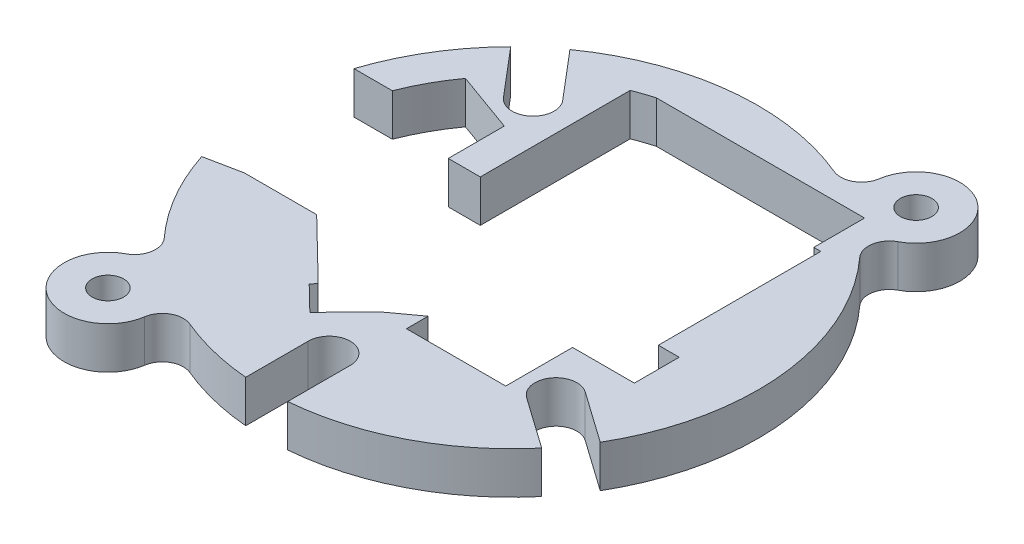
from build123d import *

# Parameters (mm, degrees)
SKETCH1_R             = 1.143
BOSS_EXTRUDE1_DEPTH   = 1.524
BOSS_EXTRUDE1_2_DEPTH = 1.524
SKETCH2_R             = 1.143
CUT_EXTRUDE2_DEPTH    = 26.441049651
SKETCH3_R             = 1.143
BOSS_EXTRUDE2_DEPTH   = 3.048


with BuildPart() as part:
    # Sketch1 → Boss-Extrude1 (new, symmetric)
    with BuildSketch(Plane(origin=(0, 0, 0), x_dir=(1, 0, 0), z_dir=(0, 1, 0))):
        with BuildLine():
            Line((-14.395123673, -5.0038), (-16.984058744, -5.5245))
            ThreePointArc((-16.984058744, -5.5245), (10.284594762, -14.601556843), (10.922, 14.131109924))
            Line((10.922, 14.131109924), (10.922, 10.9728))
            Line((10.922, 10.9728), (11.43, 10.9728))
            Line((11.43, 10.9728), (11.43, -0.8128))
            Line((11.43, -0.8128), (12.9413, -0.8128))
            Line((12.9413, -0.8128), (12.9413, -4.064))
            Line((12.9413, -4.064), (8.4582, -4.064))
            Line((8.4582, -4.064), (8.4582, -8.9154))
            Line((8.4582, -8.9154), (1.2573, -8.9154))
            Line((1.2573, -8.9154), (1.2573, -7.3406))
            Line((1.2573, -7.3406), (-0.7747, -8.8265))
            Line((-0.7747, -8.8265), (-3.273729572, -11.3919))
            Line((-3.273729572, -11.3919), (-5.093162196, -9.619538602))
            Line((-5.093162196, -9.619538602), (-4.769706241, -9.287492148))
            Line((-4.769706241, -9.287492148), (-9.167166743, -5.0038))
            Line((-9.167166743, -5.0038), (-14.395123673, -5.0038))
        make_face()
        with Locations(Location((0, -13.2588, 0), (0, 0, 90))):
            Circle(SKETCH1_R, mode=Mode.SUBTRACT)
        with Locations(Location((10.832526773, -7.6454, 0), (0, 0, 90))):
            Circle(SKETCH1_R, mode=Mode.SUBTRACT)
    extrude(amount=BOSS_EXTRUDE1_DEPTH, both=True)


with BuildPart() as body_2:
    # Sketch1 → Boss-Extrude1 2 (new, symmetric)
    with BuildSketch(Plane(origin=(0, 0, 0), x_dir=(1, 0, 0), z_dir=(0, 1, 0))):
        with BuildLine():
            Line((-4.179129857, 14.6558), (10.207148379, 14.6558))
            ThreePointArc((10.207148379, 14.6558), (-5.685665172, 16.930787437), (-16.984058744, 5.5245))
            Line((-16.984058744, 5.5245), (-14.203432675, 5.5245))
            ThreePointArc((-14.203432675, 5.5245), (-13.378320264, 7.299188099), (-12.332576282, 8.9535))
            Line((-12.332576282, 8.9535), (-7.9248, 7.366))
            Line((-7.9248, 7.366), (-7.9248, 3.302))
            Line((-7.9248, 3.302), (-5.6007, 3.302))
            Line((-5.6007, 3.302), (-5.6007, 14.173558463))
            ThreePointArc((-5.6007, 14.173558463), (-4.895856129, 14.43219293), (-4.179129857, 14.6558))
        make_face()
        with Locations(Location((-8.579035657, 10.1092, 0), (0, 0, 90))):
            Circle(SKETCH1_R, mode=Mode.SUBTRACT)
    extrude(amount=BOSS_EXTRUDE1_2_DEPTH, both=True)


with BuildPart() as cut_extrude2_tool:
    # Sketch2 → Cut-Extrude2 (new, through all)
    # profile 1 of 3: a face of its own
    with BuildSketch(Plane(origin=(0, 1.524, 0), x_dir=(1, 0, 0), z_dir=(0, 1, 0))):
        with BuildLine():
            Line((-12.676023011, 12.581605315), (-9.741012668, 9.123103947))
            ThreePointArc((-9.741012668, 9.123103947), (-7.592939604, 8.947222989), (-7.417058645, 11.095296053))
            Line((-7.417058645, 11.095296053), (-10.352068988, 14.55379742))
            ThreePointArc((-10.352068988, 14.55379742), (-11.556194906, 13.61736799), (-12.676023011, 12.581605315))
        make_face()
        with Locations((-8.579035657, 10.1092)):
            Circle(SKETCH2_R, mode=Mode.SUBTRACT)
    # profile 2 of 3: a face of its own
    with BuildSketch(Plane(origin=(0, 1.524, 0), x_dir=(1, 0, 0), z_dir=(0, 1, 0))):
        with BuildLine():
            Line((1.524, -17.794824407), (1.524, -13.2588))
            ThreePointArc((1.524, -13.2588), (0, -11.7348), (-1.524, -13.2588))
            Line((-1.524, -13.2588), (-1.524, -17.794824407))
            ThreePointArc((-1.524, -17.794824407), (0, -17.859965052), (1.524, -17.794824407))
        make_face()
        with Locations((0, -13.2588)):
            Circle(SKETCH2_R, mode=Mode.SUBTRACT)
    # profile 3 of 3: a face of its own
    with BuildSketch(Plane(origin=(0, 1.524, 0), x_dir=(1, 0, 0), z_dir=(0, 1, 0))):
        with BuildLine():
            Line((9.953745163, -8.89051802), (13.659706927, -11.506118301))
            ThreePointArc((13.659706927, -11.506118301), (14.591708872, -10.298562224), (15.417270145, -9.015882261))
            Line((15.417270145, -9.015882261), (11.711308382, -6.40028198))
            ThreePointArc((11.711308382, -6.40028198), (9.587408753, -6.766618391), (9.953745163, -8.89051802))
        make_face()
        with Locations((10.832526773, -7.6454)):
            Circle(SKETCH2_R, mode=Mode.SUBTRACT)
    extrude(amount=-CUT_EXTRUDE2_DEPTH)


with BuildPart() as part_1:
    add(part.part)

    # Cut-Extrude2: cut by cut_extrude2_tool
    add(cut_extrude2_tool.part, mode=Mode.SUBTRACT)



with BuildPart() as body_2_1:
    add(body_2.part)

    # Cut-Extrude2: cut by cut_extrude2_tool
    add(cut_extrude2_tool.part, mode=Mode.SUBTRACT)


with BuildPart() as part_2:
    add(part_1.part)

    add(body_2_1.part)  # Boss-Extrude2 merges body 2
    # Sketch3 → Boss-Extrude2 (add)
    # profile 1 of 2: a face of its own
    with BuildSketch(Plane(origin=(0, 1.524, 0), x_dir=(1, 0, 0), z_dir=(0, 1, 0))):
        with BuildLine():
            ThreePointArc((6.893924032, 16.475805386), (8.598824007, 15.653708103), (10.207148379, 14.6558))
            Line((10.207148379, 14.6558), (10.922, 14.6558))
            Line((10.922, 14.6558), (10.922, 14.131109924))
            ThreePointArc((10.922, 14.131109924), (12.114466388, 13.123187715), (13.214344503, 12.014967792))
            ThreePointArc((13.214344503, 12.014967792), (12.840241174, 13.300024042), (13.624339722, 14.384695574))
            ThreePointArc((13.624339722, 14.384695574), (13.960152262, 19.779700621), (8.989376751, 17.655967979))
            ThreePointArc((8.989376751, 17.655967979), (8.230051983, 16.553811563), (6.893924032, 16.475805386))
        make_face()
        with Locations(Location((12.129357243, 17.185704746, 0), (0, 0, 270))):
            Circle(SKETCH3_R, mode=Mode.SUBTRACT)
    # profile 2 of 2: a face of its own
    with BuildSketch(Plane(origin=(0, 1.524, 0), x_dir=(1, 0, 0), z_dir=(0, 1, 0))):
        with BuildLine():
            ThreePointArc((-13.214344503, -12.014967792), (-12.840241174, -13.300024042), (-13.624339722, -14.384695574))
            ThreePointArc((-13.624339722, -14.384695574), (-13.960152262, -19.779700621), (-8.989376751, -17.655967979))
            ThreePointArc((-8.989376751, -17.655967979), (-8.230051983, -16.553811563), (-6.893924032, -16.475805386))
            ThreePointArc((-6.893924032, -16.475805386), (-10.298562224, -14.591708872), (-13.214344503, -12.014967792))
        make_face()
        with Locations(Location((-12.129357243, -17.185704746, 0), (0, 0, 270))):
            Circle(SKETCH3_R, mode=Mode.SUBTRACT)
    extrude(amount=-BOSS_EXTRUDE2_DEPTH)


solid = part_2.part
